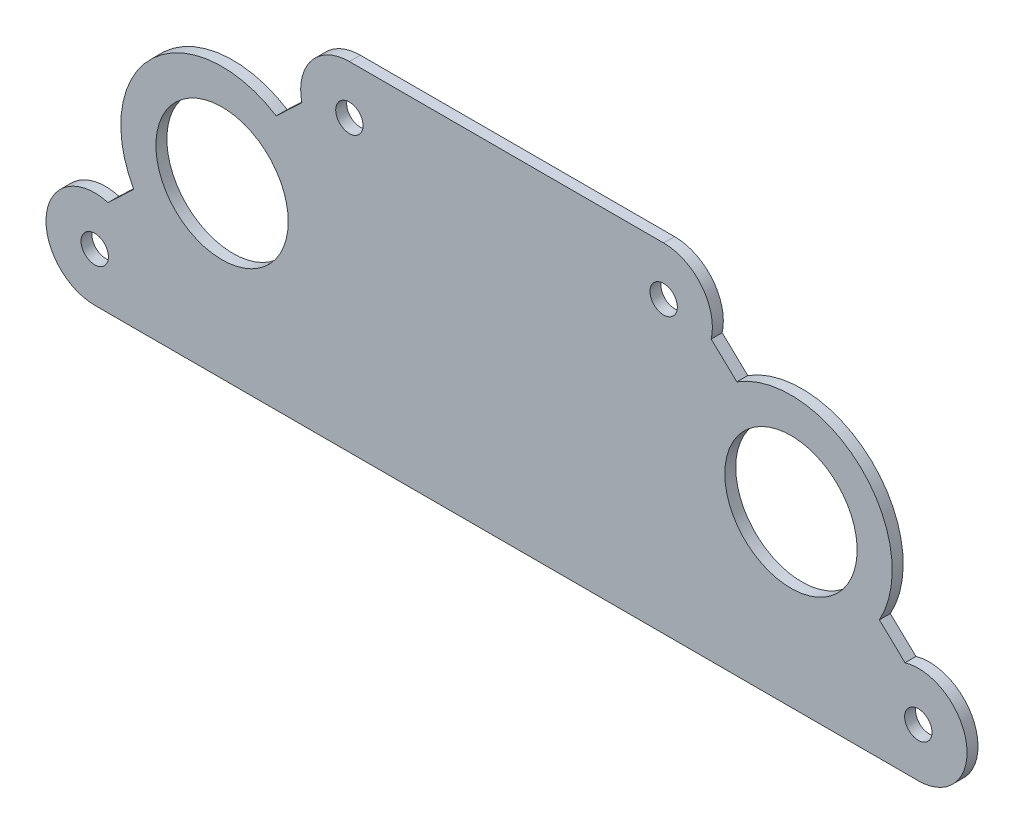
from build123d import *

# Parameters (mm, degrees)
SKETCH1_R           = 1.9812
SKETCH1_R_2         = 9.5885
BOSS_EXTRUDE1_DEPTH = 1.5875


with BuildPart() as part:
    # Sketch1 → Boss-Extrude1 (new body)
    with BuildSketch(Plane.XY):
        with BuildLine():
            Line((-156.779774808, 13.544563035), (-37.44917733, 13.544563035))
            ThreePointArc((-37.44917733, 13.544563035), (-30.455296249, 21.578477211), (-39.376058675, 27.398970946))
            Line((-39.376058675, 27.398970946), (-43.090572863, 30.913874067))
            ThreePointArc((-43.090572863, 30.913874067), (-45.816597783, 48.718236551), (-63.74425571, 50.457666506))
            Line((-63.74425571, 50.457666506), (-67.458769898, 53.972569627))
            ThreePointArc((-67.458769898, 53.972569627), (-68.834377223, 59.933132802), (-74.347952883, 62.582867186))
            Line((-74.347952883, 62.582867186), (-119.880999255, 62.582867186))
            ThreePointArc((-119.880999255, 62.582867186), (-125.394574915, 59.933132802), (-126.770182239, 53.972569627))
            Line((-126.770182239, 53.972569627), (-130.484696428, 50.457666506))
            ThreePointArc((-130.484696428, 50.457666506), (-148.412354355, 48.718236551), (-151.138379275, 30.913874067))
            Line((-151.138379275, 30.913874067), (-154.852893463, 27.398970946))
            ThreePointArc((-154.852893463, 27.398970946), (-163.773655888, 21.578477211), (-156.779774808, 13.544563035))
        make_face()
        with Locations(Location((-37.44917733, 20.605763035, 0), (0, 0, 180))):
            Circle(SKETCH1_R, mode=Mode.SUBTRACT)
        with Locations((-138.330387031, 38.06371511)):
            Circle(SKETCH1_R_2, mode=Mode.SUBTRACT)
        with Locations((-119.880999255, 55.521667186)):
            Circle(SKETCH1_R, mode=Mode.SUBTRACT)
        with Locations((-156.779774808, 20.605763035)):
            Circle(SKETCH1_R, mode=Mode.SUBTRACT)
        with Locations(Location((-74.347952883, 55.521667186, 0), (0, 0, 180))):
            Circle(SKETCH1_R, mode=Mode.SUBTRACT)
        with Locations(Location((-55.898565106, 38.06371511, 0), (0, 0, 180))):
            Circle(SKETCH1_R_2, mode=Mode.SUBTRACT)
    extrude(amount=BOSS_EXTRUDE1_DEPTH)


solid = part.part
